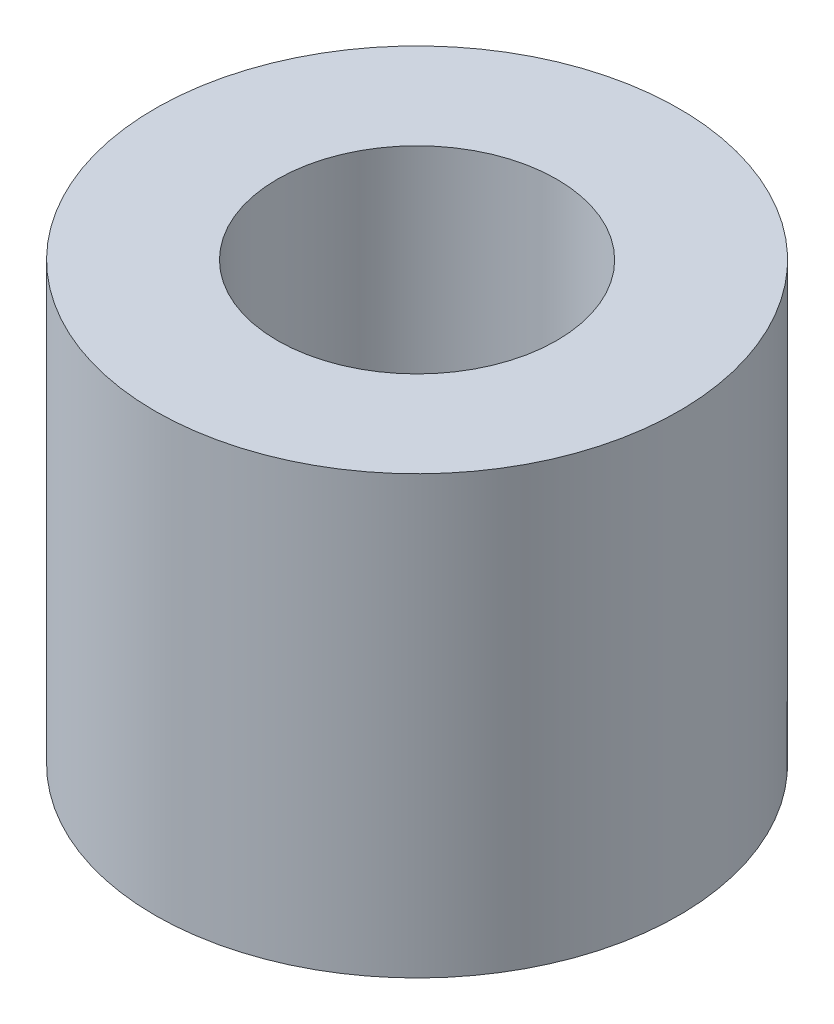
from build123d import *

# Parameters (mm, degrees)
SKICA1_R                = 3
SKICA1_R_2              = 1.6
P_IDAT_VYSUNUT_M1_DEPTH = 5


with BuildPart() as part:
    # Skica1 → Přidat vysunutím1 (new body)
    with BuildSketch(Plane(origin=(0, 0, 0), x_dir=(1, 0, 0), z_dir=(0, 1, 0))):
        with Locations(Location((0, 0, 0), (0, 0, 270))):
            Circle(SKICA1_R)
        with Locations(Location((0, 0, 0), (0, 0, 270))):
            Circle(SKICA1_R_2, mode=Mode.SUBTRACT)
    extrude(amount=P_IDAT_VYSUNUT_M1_DEPTH)


solid = part.part
